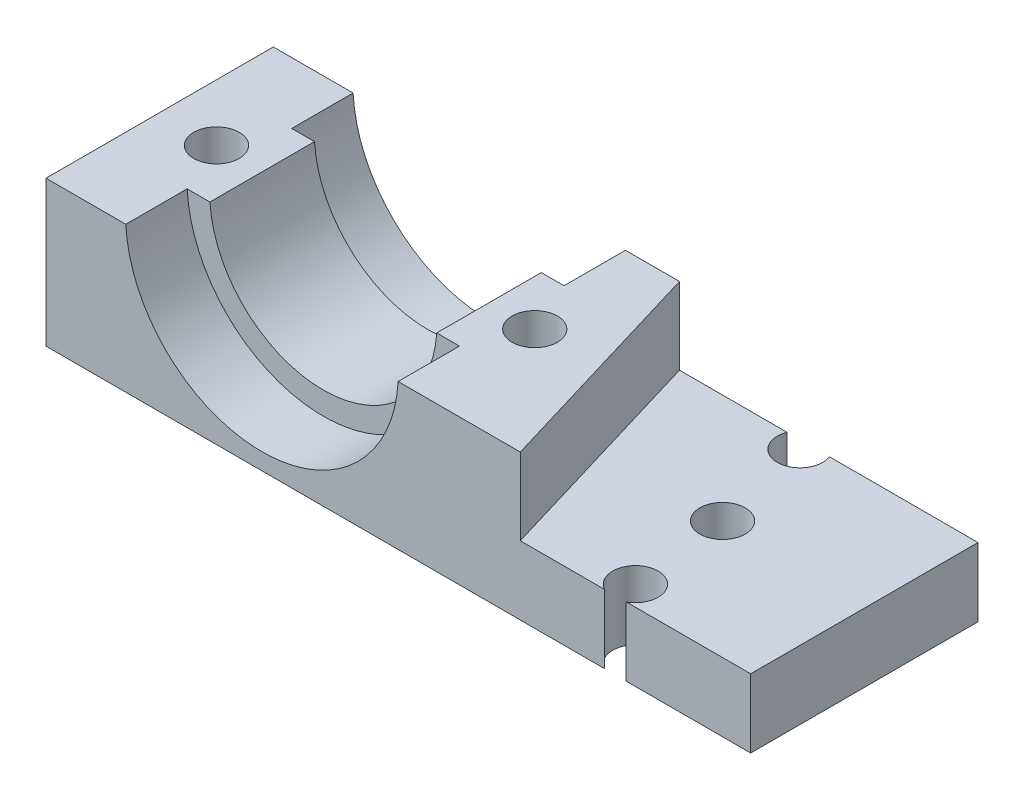
from build123d import *

# Parameters (mm, degrees)
SKETCH1_W           = 50
SKETCH1_H           = 32
BOSS_EXTRUDE1_DEPTH = 47.5
SKETCH5_W           = 50
SKETCH5_H           = 32
BOSS_EXTRUDE2_DEPTH = 60
SKETCH4_R           = 5
CUT_EXTRUDE1_DEPTH  = 75
CUT_EXTRUDE2_DEPTH  = 16.9


with BuildPart() as part:
    # Sketch1 → Boss-Extrude1 (new, symmetric)
    with BuildSketch(Plane(origin=(0, 0, 0), x_dir=(0, 0, -1), z_dir=(1, 0, 0))):
        Rectangle(SKETCH1_W, SKETCH1_H)
    extrude(amount=BOSS_EXTRUDE1_DEPTH, both=True)

    # Sketch3 → Cut-Revolve1 (revolve, cut)
    with BuildSketch(Plane(origin=(0, 0, 0), x_dir=(0, 0, -1), z_dir=(1, 0, 0))):
        Polygon((-25, -12.35), (-11.5, -12.35), (-11.5, -7.35), (11.5, -7.35), (11.5, -12.35), (25, -12.35), (25, 16.59588936), (-25, 16.59588936), align=None)
    revolve(axis=Axis((0, 17.65, -20.249126458), (0, 0, -1)), mode=Mode.SUBTRACT)

    # Sketch5 → Boss-Extrude2 (add)
    with BuildSketch(Plane(origin=(47.5, 0, 0), x_dir=(0, 0, -1), z_dir=(1, 0, 0))):
        Rectangle(SKETCH5_W, SKETCH5_H)
    extrude(amount=BOSS_EXTRUDE2_DEPTH)

    # Sketch4 → Cut-Extrude1 (cut)
    with BuildSketch(Plane(origin=(0, 16, 0), x_dir=(1, 0, 0), z_dir=(0, 1, 0))):
        with Locations(Location((-35, 0, 0), (0, 0, 270))):
            Circle(SKETCH4_R)
        with Locations(Location((35, 0, 0), (0, 0, 270))):
            Circle(SKETCH4_R)
        with Locations((77.75, -20.6)):
            Circle(SKETCH4_R)
        with Locations(Location((75.295878395, 1.01110333, 0), (0, 0, 270))):
            Circle(SKETCH4_R)
        with Locations((70.163995975, 23.188381743)):
            Circle(SKETCH4_R)
    extrude(amount=-CUT_EXTRUDE1_DEPTH, mode=Mode.SUBTRACT)

    # Sketch6 → Cut-Extrude2 (cut)
    with BuildSketch(Plane(origin=(0, 16, 0), x_dir=(1, 0, 0), z_dir=(0, 1, 0))):
        Polygon((97.41116956, -160.42016543), (40, 31.15), (103.809557411, 50.272921943), (161.220726971, -141.297243487), align=None)
    extrude(amount=-CUT_EXTRUDE2_DEPTH, mode=Mode.SUBTRACT)


solid = part.part
